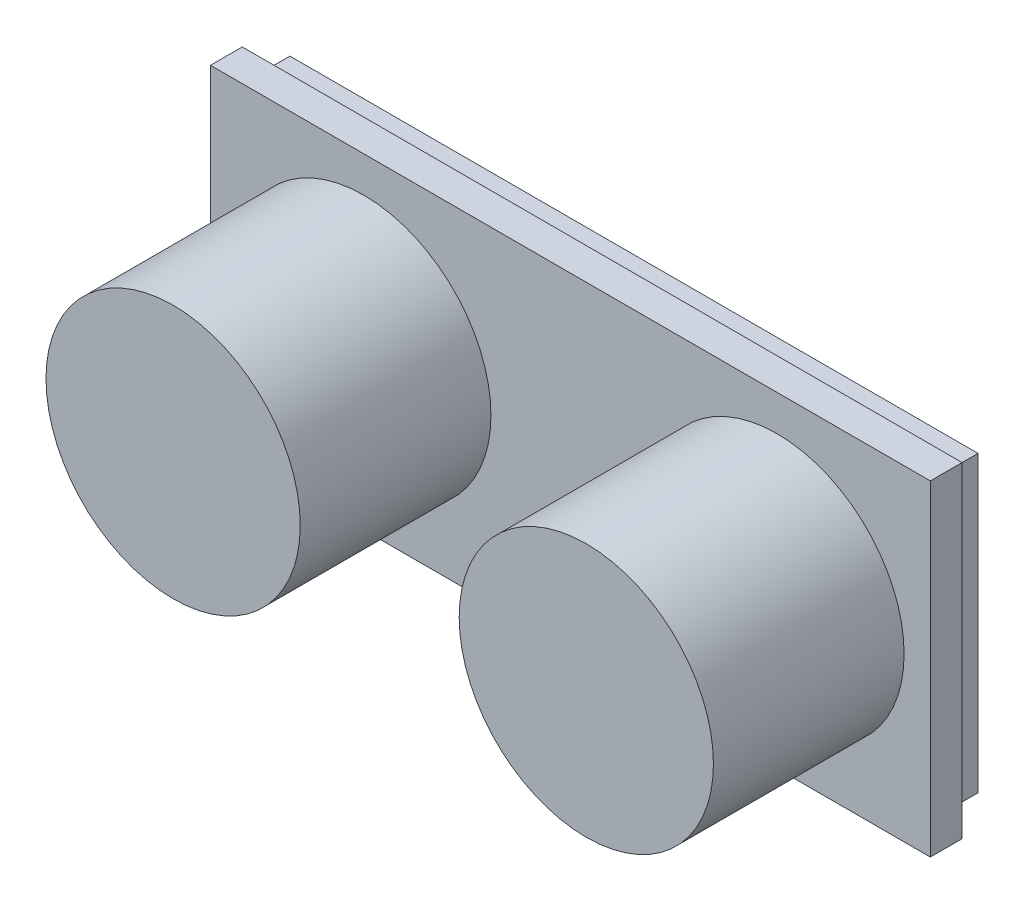
from build123d import *

# Parameters (mm, degrees)
SKETCH1_W           = 45.3
SKETCH1_H           = 20.5
BOSS_EXTRUDE1_DEPTH = 2
SKETCH2_W           = 10
SKETCH2_H           = 10
BOSS_EXTRUDE2_DEPTH = 4
SKETCH3_R           = 8
BOSS_EXTRUDE3_DEPTH = 12
BOSS_EXTRUDE4_DEPTH = 2


with BuildPart() as part:
    # Sketch1 → Boss-Extrude1 (new body)
    with BuildSketch(Plane.XY):
        Rectangle(SKETCH1_W, SKETCH1_H)
    extrude(amount=BOSS_EXTRUDE1_DEPTH)

    # Sketch2 → Boss-Extrude2 (add)
    with BuildSketch(Plane(origin=(0, 0, 0), x_dir=(-1, 0, 0), z_dir=(0, 0, -1))):
        with Locations((0, -12.25)):
            Rectangle(SKETCH2_W, SKETCH2_H)
    extrude(amount=BOSS_EXTRUDE2_DEPTH)

    # Sketch3 → Boss-Extrude3 (add)
    with BuildSketch(Plane.XY.offset(2)):
        with Locations(Location((13, 0, 0), (0, 0, 180))):
            Circle(SKETCH3_R)
        with Locations(Location((-13, 0, 0), (0, 0, 180))):
            Circle(SKETCH3_R)
    extrude(amount=BOSS_EXTRUDE3_DEPTH)

    # Sketch4 → Boss-Extrude4 (add)
    with BuildSketch(Plane(origin=(0, 0, 0), x_dir=(-1, 0, 0), z_dir=(0, 0, -1))):
        Polygon((-6, -9.25), (-6, -6.25), (6, -6.25), (6, -9.25), (21.65, -9.25), (21.65, 9.25), (-21.65, 9.25), (-21.65, -9.25), align=None)
    extrude(amount=BOSS_EXTRUDE4_DEPTH)


solid = part.part
